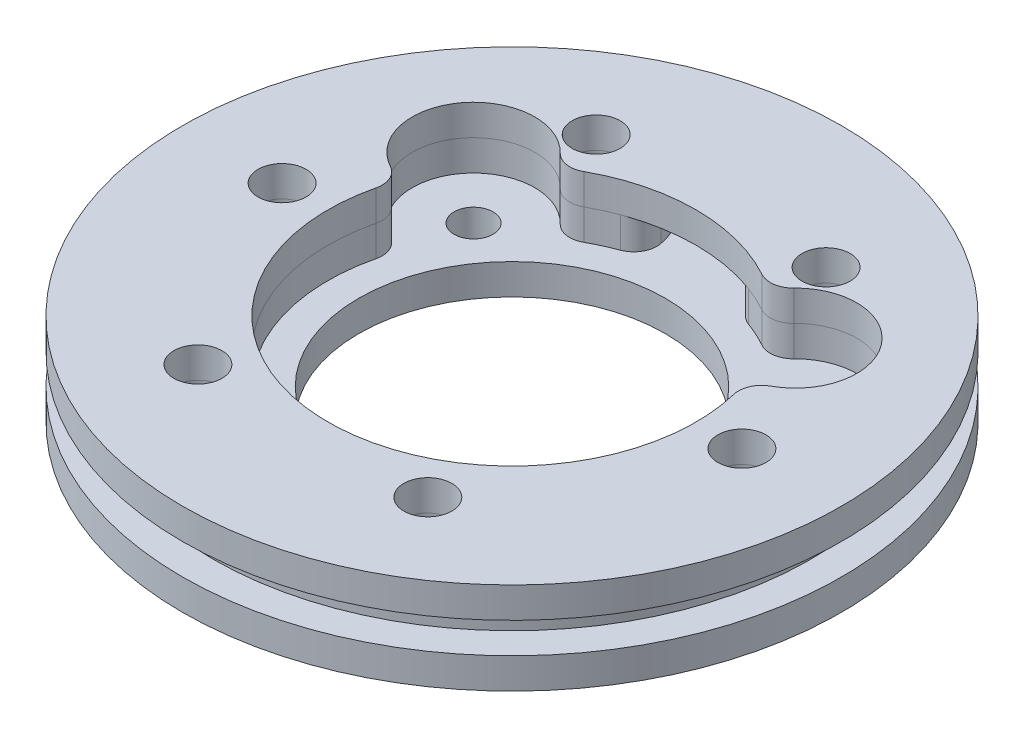
from build123d import *

# Parameters (mm, degrees)
SKETCH1_R           = 2.4892
BOSS_EXTRUDE1_DEPTH = 3.175
SKETCH2_R           = 34.13125
SKETCH2_R_2         = 2.4892
SKETCH2_R_3         = 15.875
SKETCH2_R_4         = 2.0193
BOSS_EXTRUDE2_DEPTH = 3.175
SKETCH3_R           = 6.35
CUT_EXTRUDE1_DEPTH  = 3.175
SKETCH4_R           = 34.13125
SKETCH4_R_2         = 2.4892
BOSS_EXTRUDE3_DEPTH = 3.175
FILLET2_R           = 2.38125
FILLET3_R           = 2.38125


with BuildPart() as part:
    # Sketch1 → Boss-Extrude1 (new body)
    with BuildSketch(Plane(origin=(0, 0, 0), x_dir=(1, 0, 0), z_dir=(0, 1, 0))):
        with BuildLine():
            ThreePointArc((-17.376939313, 25.618965517), (-14.497664233, -27.351547412), (30.95625, 0))
            ThreePointArc((30.95625, 0), (27.351547412, 14.497664233), (17.376939313, 25.618965517))
            ThreePointArc((17.376939313, 25.618965517), (8.910502717, 25.899620451), (5.012244188, 18.378789628))
            ThreePointArc((5.012244188, 18.378789628), (15.139117408, 11.563287772), (19.05, 0))
            ThreePointArc((19.05, 0), (-11.563287772, -15.139117408), (-5.012244188, 18.378789628))
            ThreePointArc((-5.012244188, 18.378789628), (-8.910502717, 25.899620451), (-17.376939313, 25.618965517))
        make_face()
        with Locations(Location((-11.90625, -20.622229928, 0), (0, 0, 270))):
            Circle(SKETCH1_R, mode=Mode.SUBTRACT)
        with Locations(Location((-23.8125, 0, 0), (0, 0, 270))):
            Circle(SKETCH1_R, mode=Mode.SUBTRACT)
        with Locations(Location((11.90625, -20.622229928, 0), (0, 0, 270))):
            Circle(SKETCH1_R, mode=Mode.SUBTRACT)
        with Locations(Location((-11.90625, 20.622229928, 0), (0, 0, 270))):
            Circle(SKETCH1_R, mode=Mode.SUBTRACT)
        with Locations(Location((23.8125, 0, 0), (0, 0, 270))):
            Circle(SKETCH1_R, mode=Mode.SUBTRACT)
        with Locations(Location((11.90625, 20.622229928, 0), (0, 0, 270))):
            Circle(SKETCH1_R, mode=Mode.SUBTRACT)
    extrude(amount=-BOSS_EXTRUDE1_DEPTH)

    # Sketch3 → Cut-Extrude1 (cut)
    with BuildSketch(Plane(origin=(0, 0, 0), x_dir=(1, 0, 0), z_dir=(0, 1, 0))):
        with Locations((-16.66875, 12.684729928)):
            Circle(SKETCH3_R)
        with Locations((16.66875, 12.684729928)):
            Circle(SKETCH3_R)
    extrude(amount=-CUT_EXTRUDE1_DEPTH, mode=Mode.SUBTRACT)

    # Fillet2
    fillet2_edges = [part.edges().sort_by_distance(p)[0] for p in [
        (-5.012244188, -1.5875, -18.378789628),
        (5.012244188, -1.5875, -18.378789628),
        (-17.921417106, -1.5875, -6.459513054),
        (-11.002626975, -1.5875, -15.551356842),
        (11.002626975, -1.5875, -15.551356842),
        (17.921417106, -1.5875, -6.459513054),
    ]]
    fillet(fillet2_edges, radius=FILLET2_R)


with BuildPart() as body_2:
    # Sketch2 → Boss-Extrude2 (new body)
    with BuildSketch(Plane(origin=(0, -3.175, 0), x_dir=(-1, 0, 0), z_dir=(0, -1, 0))):
        with Locations(Location((0, 0, 0), (0, 0, 90))):
            Circle(SKETCH2_R)
        with Locations(Location((-11.90625, 20.622229928, 0), (0, 0, 90))):
            Circle(SKETCH2_R_2, mode=Mode.SUBTRACT)
        with Locations(Location((-23.8125, 0, 0), (0, 0, 90))):
            Circle(SKETCH2_R_2, mode=Mode.SUBTRACT)
        with Locations(Location((-11.90625, -20.622229928, 0), (0, 0, 90))):
            Circle(SKETCH2_R_2, mode=Mode.SUBTRACT)
        with Locations(Location((11.90625, -20.622229928, 0), (0, 0, 90))):
            Circle(SKETCH2_R_2, mode=Mode.SUBTRACT)
        with Locations(Location((11.90625, 20.622229928, 0), (0, 0, 90))):
            Circle(SKETCH2_R_2, mode=Mode.SUBTRACT)
        with Locations(Location((23.8125, 0, 0), (0, 0, 90))):
            Circle(SKETCH2_R_2, mode=Mode.SUBTRACT)
        with Locations(Location((0, 0, 0), (0, 0, 90))):
            Circle(SKETCH2_R_3, mode=Mode.SUBTRACT)
        with Locations(Location((16.66875, 12.684729928, 0), (0, 0, 90))):
            Circle(SKETCH2_R_4, mode=Mode.SUBTRACT)
        with Locations(Location((-16.66875, 12.684729928, 0), (0, 0, 90))):
            Circle(SKETCH2_R_4, mode=Mode.SUBTRACT)
    extrude(amount=BOSS_EXTRUDE2_DEPTH)


with BuildPart() as body_3:
    # Sketch4 → Boss-Extrude3 (new body)
    # profile 1 of 2: a face of its own
    with BuildSketch(Plane(origin=(0, 0, 0), x_dir=(1, 0, 0), z_dir=(0, 1, 0))):
        with Locations(Location((0, 0, 0), (0, 0, 270))):
            Circle(SKETCH4_R)
        with BuildLine():
            ThreePointArc((5.012244188, 18.378789628), (0, 19.05), (-5.012244188, 18.378789628))
            ThreePointArc((-5.012244188, 18.378789628), (-8.910502717, 25.899620451), (-17.376939313, 25.618965517))
            ThreePointArc((-17.376939313, 25.618965517), (0, -30.95625), (17.376939313, 25.618965517))
            ThreePointArc((17.376939313, 25.618965517), (8.910502717, 25.899620451), (5.012244188, 18.378789628))
        make_face(mode=Mode.SUBTRACT)
    # profile 2 of 2: a face of its own
    with BuildSketch(Plane(origin=(0, 0, 0), x_dir=(1, 0, 0), z_dir=(0, 1, 0))):
        with BuildLine():
            ThreePointArc((17.921417106, 6.459513054), (0, -19.05), (-17.921417106, 6.459513054))
            ThreePointArc((-17.921417106, 6.459513054), (-21.721972156, 16.530174745), (-11.002626975, 15.551356842))
            ThreePointArc((-11.002626975, 15.551356842), (-8.131274109, 17.227445584), (-5.012244188, 18.378789628))
            ThreePointArc((-5.012244188, 18.378789628), (-8.910502717, 25.899620451), (-17.376939313, 25.618965517))
            ThreePointArc((-17.376939313, 25.618965517), (0, -30.95625), (17.376939313, 25.618965517))
            ThreePointArc((17.376939313, 25.618965517), (8.910502717, 25.899620451), (5.012244188, 18.378789628))
            ThreePointArc((5.012244188, 18.378789628), (8.131274109, 17.227445584), (11.002626975, 15.551356842))
            ThreePointArc((11.002626975, 15.551356842), (21.721972156, 16.530174745), (17.921417106, 6.459513054))
        make_face()
        with Locations(Location((11.90625, -20.622229928, 0), (0, 0, 270))):
            Circle(SKETCH4_R_2, mode=Mode.SUBTRACT)
        with Locations(Location((-23.8125, 0, 0), (0, 0, 270))):
            Circle(SKETCH4_R_2, mode=Mode.SUBTRACT)
        with Locations(Location((11.90625, 20.622229928, 0), (0, 0, 270))):
            Circle(SKETCH4_R_2, mode=Mode.SUBTRACT)
        with Locations(Location((23.8125, 0, 0), (0, 0, 270))):
            Circle(SKETCH4_R_2, mode=Mode.SUBTRACT)
        with Locations(Location((-11.90625, 20.622229928, 0), (0, 0, 270))):
            Circle(SKETCH4_R_2, mode=Mode.SUBTRACT)
        with Locations(Location((-11.90625, -20.622229928, 0), (0, 0, 270))):
            Circle(SKETCH4_R_2, mode=Mode.SUBTRACT)
    extrude(amount=BOSS_EXTRUDE3_DEPTH)

    # Fillet3
    fillet3_edges = [body_3.edges().sort_by_distance(p)[0] for p in [
        (17.921417106, 1.5875, -6.459513054),
        (11.002626975, 1.5875, -15.551356842),
        (-11.002626975, 1.5875, -15.551356842),
        (-17.921417106, 1.5875, -6.459513054),
    ]]
    fillet(fillet3_edges, radius=FILLET3_R)


solid = Compound([part.part, body_2.part, body_3.part])
